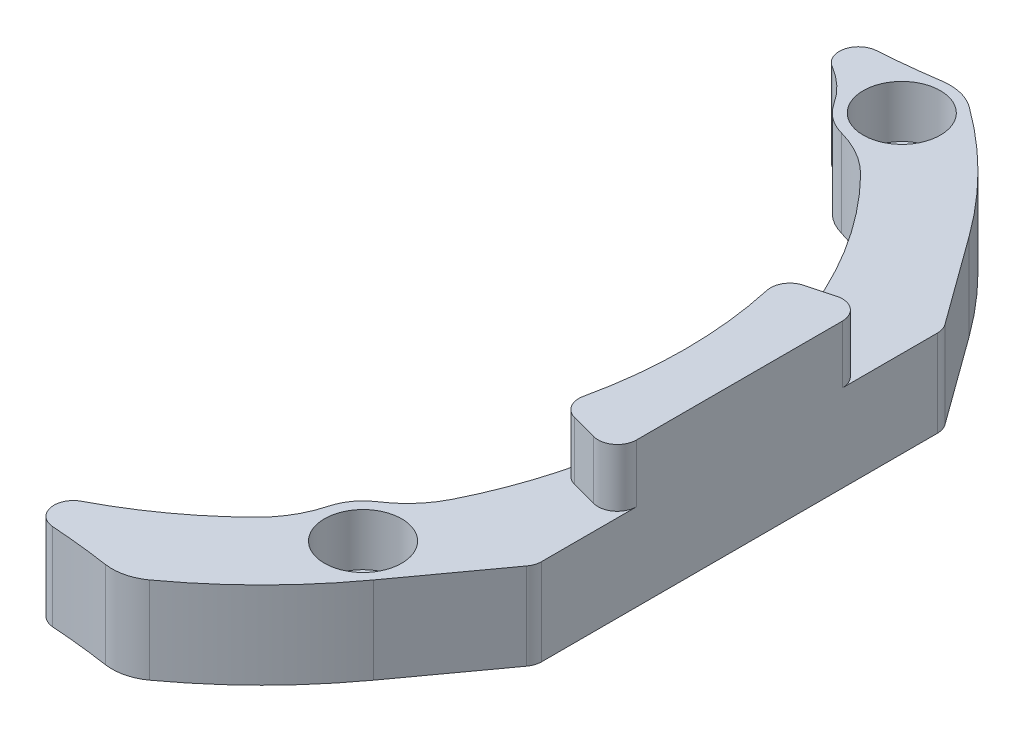
from build123d import *

# Parameters (mm, degrees)
SKETCH_1_R                     = 1.0250000000000292
EXTRUDE_1_DEPTH                = 4.5
EXTRUDE_1_2_DEPTH              = 4.5
EXTRUDE_START                  = -4.5
EXTRUDE_2_DEPTH                = 4.5
EXTRUDE_3_DEPTH                = 3
SKETCH_7_R                     = 1.45
SKETCH_7_R_2                   = 1.0000000000000018
EXTRUDE_5_DEPTH                = 4.5
HOLE_WIZARD_M2_5_2_D           = 2.9
HOLE_WIZARD_M2_5_2_CBORE_D     = 4
HOLE_WIZARD_M2_5_2_CBORE_DEPTH = 2.7
FILLET_5_R                     = 1


with BuildPart() as part:
    # 草图1 → 凸台-拉伸1 (new body)
    with BuildSketch(Plane(origin=(0, 0, 0), x_dir=(1, 0, 0), z_dir=(0, 1, 0))):
        with BuildLine():
            ThreePointArc((21.348606100588817, 5.102893058050916), (21.291819851832585, 9.358175160870491), (21.68743992704855, 13.595407182923395))
            ThreePointArc((21.687439927048548, 13.595407182923395), (21.641903090720017, 14.556584323583055), (21.236696102342364, 15.429362872677498))
            ThreePointArc((21.236696102342368, 15.429362872677501), (18.56155300614698, 18.56155300614684), (15.429362872677654, 21.236696102342243))
            ThreePointArc((15.429362872677654, 21.23669610234224), (14.556584323583243, 21.641903090720017), (13.595407182923555, 21.68743992704845))
            ThreePointArc((13.595407182923555, 21.687439927048445), (10.687287616312432, 21.367018761558228), (7.763526238556964, 21.26002089734574))
            ThreePointArc((7.763526238556963, 21.260020897345733), (6.432472496268358, 21.282173332286177), (5.102893058051164, 21.348606100588782))
            ThreePointArc((5.1028930580511656, 21.348606100588796), (7.485262352646101, 20.634276035569133), (9.771526987407864, 19.65501870602934))
            ThreePointArc((9.771526987407862, 19.655018706029338), (10.918636162855368, 18.878721056795385), (11.820114941555765, 17.82713486814756))
            ThreePointArc((11.820114941555765, 17.82713486814756), (12.461047348600456, 17.151160280748954), (13.301996390818283, 16.750484973796134))
            ThreePointArc((13.301996390818283, 16.750484973796134), (14.580686550664556, 16.218085710353485), (15.673465718169814, 15.367009220448802))
            ThreePointArc((15.673465718169815, 15.367009220448805), (19.20928084513133, 10.621018285120913), (21.348606100588796, 5.102893058050913))
        make_face()
        with Locations(Location((13.959899741946257, 19.214153616405042, 0), (0, 0, 270))):
            Circle(SKETCH_1_R, mode=Mode.SUBTRACT)
    extrude(amount=EXTRUDE_1_DEPTH)



with BuildPart() as body_2:
    # 草图1 → Extrude 1 2 (new body)
    with BuildSketch(Plane(origin=(0, 0, 0), x_dir=(1, 0, 0), z_dir=(0, 1, 0))):
        with BuildLine():
            ThreePointArc((21.687439927048345, -13.59540718292358), (21.291819851832443, -9.358175160870594), (21.348606100588746, -5.102893058050941))
            ThreePointArc((21.348606100588746, -5.10289305805094), (20.63427603556909, -7.4852623526459166), (19.655018706029292, -9.771526987407722))
            ThreePointArc((19.655018706029292, -9.77152698740772), (18.87872105679534, -10.918636162855227), (17.827134868147517, -11.82011494155563))
            ThreePointArc((17.827134868147517, -11.82011494155563), (17.151160280748865, -12.461047348600282), (16.7504849737961, -13.301996390818143))
            ThreePointArc((16.7504849737961, -13.301996390818143), (16.218085710353446, -14.580686550664424), (15.367009220448757, -15.673465718169691))
            ThreePointArc((15.367009220448761, -15.673465718169693), (10.621018285120737, -19.209280845131296), (5.1028930580505785, -21.348606100588768))
            ThreePointArc((5.102893058050578, -21.348606100588754), (9.35817516087026, -21.29181985183253), (13.595407182923264, -21.68743992704851))
            ThreePointArc((13.595407182923264, -21.687439927048516), (13.777164655836453, -21.707466249891656), (13.959899741946161, -21.714153616404968))
            ThreePointArc((13.959899741946161, -21.714153616404968), (14.732442227883533, -21.591794907142855), (15.429362872677345, -21.236696102342332))
            ThreePointArc((15.429362872677347, -21.236696102342336), (18.561553006146696, -18.561553006146962), (21.23669610234214, -15.429362872677675))
            ThreePointArc((21.236696102342137, -15.429362872677672), (21.64190309071992, -14.556584323583264), (21.687439927048352, -13.595407182923577))
        make_face()
        with BuildLine():
            ThreePointArc((19.21415361640496, -12.509899741946258), (20.66415361640495, -13.95989974194627), (19.214153616404936, -15.409899741946257))
            ThreePointArc((19.214153616404936, -15.409899741946255), (17.76415361640495, -13.959899741946243), (19.21415361640496, -12.509899741946256))
        make_face(mode=Mode.SUBTRACT)
    extrude(amount=EXTRUDE_1_2_DEPTH)


with BuildPart() as part_1:
    add(part.part)

    add(body_2.part)  # 凸台-拉伸2 merges body 2
    # 草图4 → 凸台-拉伸2 (add)
    with BuildSketch(Plane(origin=(0, 4.5, 0), x_dir=(1, 0, 0), z_dir=(0, 1, 0)).offset(EXTRUDE_START)):
        with BuildLine():
            Line((21.236696102342133, -15.429362872677666), (24.7634076160975, -10.575260906428365))
            Line((24.7634076160975, -10.575260906428365), (24.7634076160975, 10.575260906428364))
            Line((24.7634076160975, 10.575260906428364), (21.236696102342353, 15.429362872677489))
            ThreePointArc((21.236696102342353, 15.429362872677489), (21.641903090720028, 14.556584323583055), (21.687439927048562, 13.595407182923394))
            ThreePointArc((21.687439927048562, 13.595407182923394), (21.2918198518326, 9.358175160870505), (21.348606100588814, 5.102893058050923))
            ThreePointArc((21.348606100588814, 5.102893058050923), (21.950000000000014, -1.41e-14), (21.34860610058875, -5.102893058050941))
            ThreePointArc((21.34860610058875, -5.102893058050941), (21.291819851832443, -9.358175160870587), (21.687439927048448, -13.595407182923562))
            ThreePointArc((21.687439927048448, -13.595407182923562), (21.64190309071992, -14.556584323583241), (21.236696102342133, -15.429362872677666))
        make_face()
    extrude(amount=EXTRUDE_2_DEPTH)

    # 草图5 → 凸台-拉伸3 (add)
    with BuildSketch(Plane(origin=(0, 4.5, 0), x_dir=(1, 0, 0), z_dir=(0, 1, 0))):
        with BuildLine():
            Line((21.20207188704507, -5.68107804000035), (24.7634076160975, -6.635335072576056))
            Line((24.7634076160975, -6.635335072576056), (24.7634076160975, 6.635335072576056))
            Line((24.7634076160975, 6.635335072576056), (21.202071887045097, 5.681078040000357))
            ThreePointArc((21.202071887045097, 5.681078040000357), (21.950000000000045, 2.96e-15), (21.20207188704507, -5.68107804000035))
        make_face()
    extrude(amount=EXTRUDE_3_DEPTH)

    # 草图7 → 凸台-拉伸5 (add)
    with BuildSketch(Plane(origin=(0, 4.5, 0), x_dir=(1, 0, 0), z_dir=(0, 1, 0)).offset(EXTRUDE_START)):
        with Locations((19.21415361640495, -13.959899741946257)):
            Circle(SKETCH_7_R)
        with Locations(Location((19.21415361640495, -13.959899741946257, 0), (0, 0, 270))):
            Circle(SKETCH_7_R_2, mode=Mode.SUBTRACT)
    extrude(amount=EXTRUDE_5_DEPTH)

    # M2.5 六角圆柱头螺钉的柱形沉头孔2 (through all)
    with Locations(Plane(origin=(13.959899742, 4.5, -19.214153616), x_dir=(0, 0, 1), z_dir=(0, 1, 0))):
        with Locations((0, 0), (33.174053358, 5.254253874)):
            CounterBoreHole(HOLE_WIZARD_M2_5_2_D / 2, HOLE_WIZARD_M2_5_2_CBORE_D / 2, HOLE_WIZARD_M2_5_2_CBORE_DEPTH)

    # 圆角5
    fillet_5_edges = [part_1.edges().sort_by_distance(p)[0] for p in [
        (24.7634076160975, 2.25, 10.575260906428365),
        (24.7634076160975, 2.25, -10.575260906428364),
        (24.7634076160975, 6, -6.635335072576056),
        (21.202071887045093, 6, -5.681078040000356),
        (21.202071887045065, 6, 5.681078040000351),
        (24.7634076160975, 6, 6.635335072576056),
        (5.1028930580505785, 2.25, 21.34860610058876),
        (5.102893058051165, 2.25, -21.34860610058879),
    ]]
    fillet(fillet_5_edges, radius=FILLET_5_R)


solid = part_1.part
